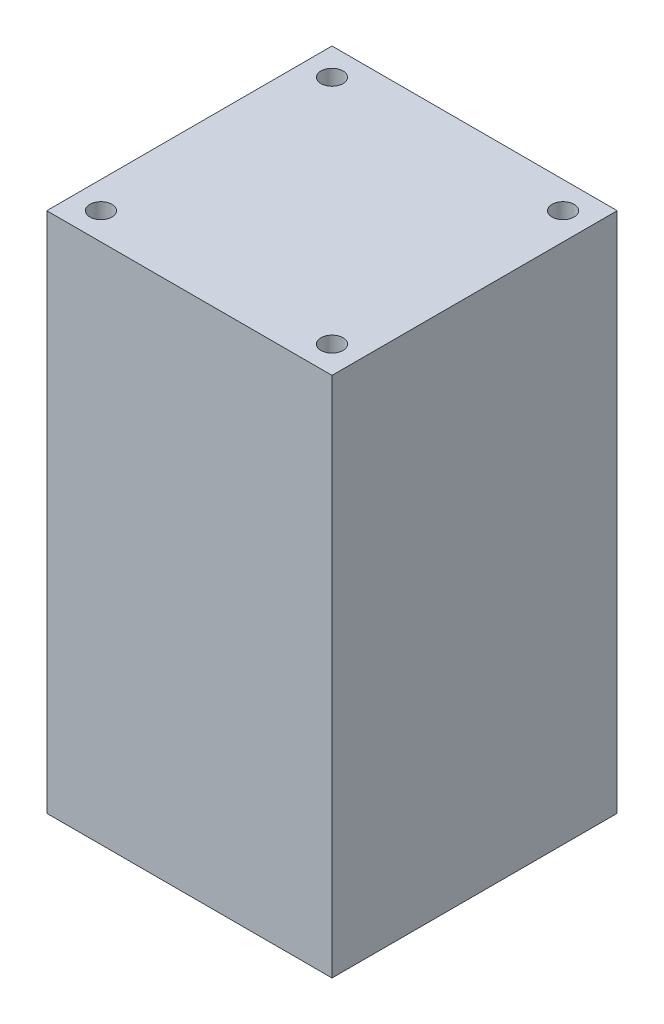
from build123d import *

# Parameters (mm, degrees)
SKETCH1_W           = 109.86
SKETCH1_H           = 109.86
SKETCH1_R           = 4.25
BOSS_EXTRUDE1_DEPTH = 201


with BuildPart() as part:
    # Sketch1 → Boss-Extrude1 (new body)
    with BuildSketch(Plane(origin=(0, 0, 0), x_dir=(1, 0, 0), z_dir=(0, 1, 0))):
        Rectangle(SKETCH1_W, SKETCH1_H)
        with Locations(Location((-44.5, 44.5, 0), (0, 0, 270))):
            Circle(SKETCH1_R, mode=Mode.SUBTRACT)
        with Locations(Location((44.5, 44.5, 0), (0, 0, 270))):
            Circle(SKETCH1_R, mode=Mode.SUBTRACT)
        with Locations(Location((44.5, -44.5, 0), (0, 0, 270))):
            Circle(SKETCH1_R, mode=Mode.SUBTRACT)
        with Locations(Location((-44.5, -44.5, 0), (0, 0, 270))):
            Circle(SKETCH1_R, mode=Mode.SUBTRACT)
    extrude(amount=-BOSS_EXTRUDE1_DEPTH)


solid = part.part
